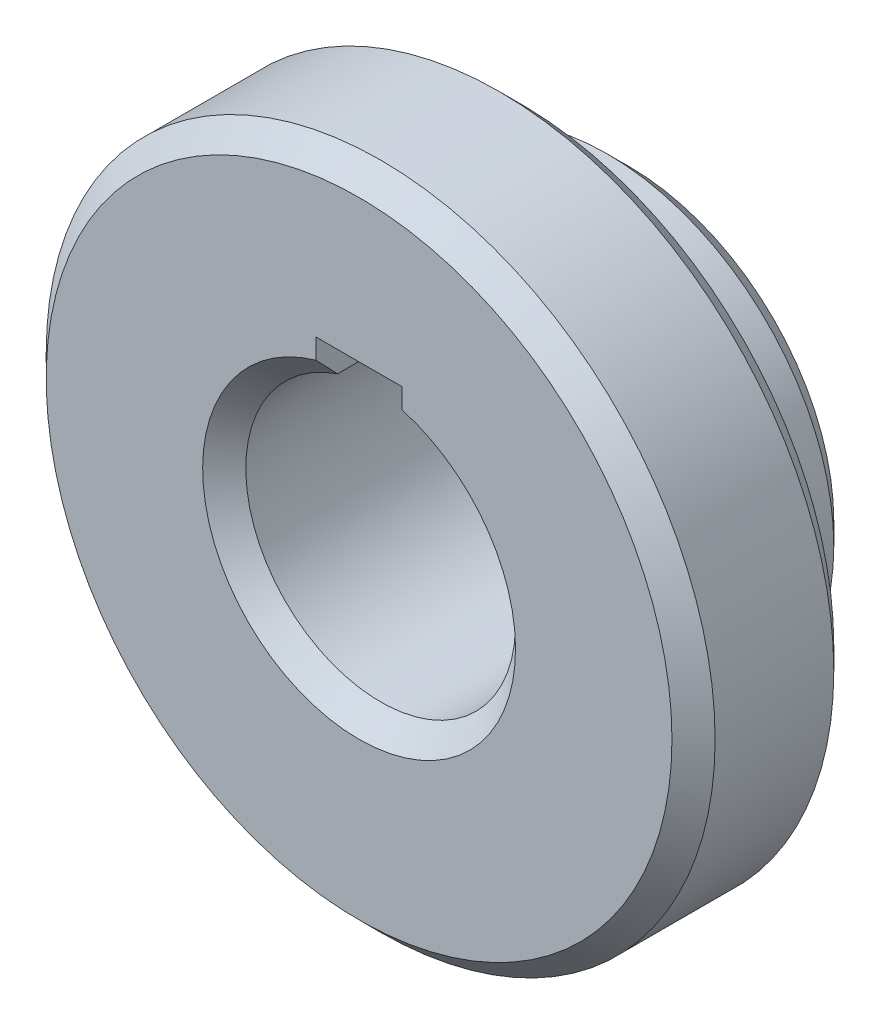
from build123d import *

# Parameters (mm, degrees)
SKETCH_1_R          = 31
EXTRUDE_1_DEPTH     = 15
SKETCH_2_R          = 21
EXTRUDE_2_DEPTH     = 10
SKETCH_3_R          = 12.5
CUT_EXTRUDE_1_DEPTH = 51.467811524
CUT_EXTRUDE_3_DEPTH = 51.467811524
CHAMFER_1_SIZE      = 2
CHAMFER_2_SIZE      = 2
CHAMFER_3_SIZE      = 2
CHAMFER_4_SIZE      = 2
CHAMFER_5_SIZE      = 2
FILLET_1_R          = 3


with BuildPart() as part:
    # 草图1 → 凸台-拉伸1 (new body)
    with BuildSketch(Plane.XY):
        Circle(SKETCH_1_R)
    extrude(amount=-EXTRUDE_1_DEPTH)

    # 草图2 → 凸台-拉伸2 (add)
    with BuildSketch(Plane(origin=(0, 0, -15), x_dir=(-1, 0, 0), z_dir=(0, 0, -1))):
        Circle(SKETCH_2_R)
    extrude(amount=EXTRUDE_2_DEPTH)

    # 草图3 → 切除-拉伸1 (cut, through all)
    with BuildSketch(Plane.XY):
        Circle(SKETCH_3_R)
    extrude(amount=-CUT_EXTRUDE_1_DEPTH, mode=Mode.SUBTRACT)

    # 草图4 → 切除-拉伸3 (cut, through all)
    with BuildSketch(Plane.XY):
        with BuildLine():
            Line((0, 15.8), (4, 15.8))
            Line((4, 15.8), (4, 11.842719282))
            ThreePointArc((4, 11.842719282), (0, 12.5), (-4, 11.842719282))
            Line((-4, 11.842719282), (-4, 15.8))
            Line((-4, 15.8), (0, 15.8))
        make_face()
    extrude(amount=-CUT_EXTRUDE_3_DEPTH, mode=Mode.SUBTRACT)

    # 倒角1
    chamfer_1_edges = [part.edges().sort_by_distance(p)[0] for p in [
        (-31, 0, 0),
    ]]
    chamfer(chamfer_1_edges, length=CHAMFER_1_SIZE)

    # 倒角2
    chamfer_2_edges = [part.edges().sort_by_distance(p)[0] for p in [
        (-31, 0, -15),
    ]]
    chamfer(chamfer_2_edges, length=CHAMFER_2_SIZE)

    # 倒角3
    chamfer_3_edges = [part.edges().sort_by_distance(p)[0] for p in [
        (0, -12.5, 0),
    ]]
    chamfer(chamfer_3_edges, length=CHAMFER_3_SIZE)

    # 倒角4
    chamfer_4_edges = [part.edges().sort_by_distance(p)[0] for p in [
        (0, -12.5, -25),
    ]]
    chamfer(chamfer_4_edges, length=CHAMFER_4_SIZE)

    # 倒角5
    chamfer_5_edges = [part.edges().sort_by_distance(p)[0] for p in [
        (21, 0, -25),
    ]]
    chamfer(chamfer_5_edges, length=CHAMFER_5_SIZE)

    # 圆角1
    fillet_1_edges = [part.edges().sort_by_distance(p)[0] for p in [
        (21, 0, -15),
    ]]
    fillet(fillet_1_edges, radius=FILLET_1_R)


solid = part.part
